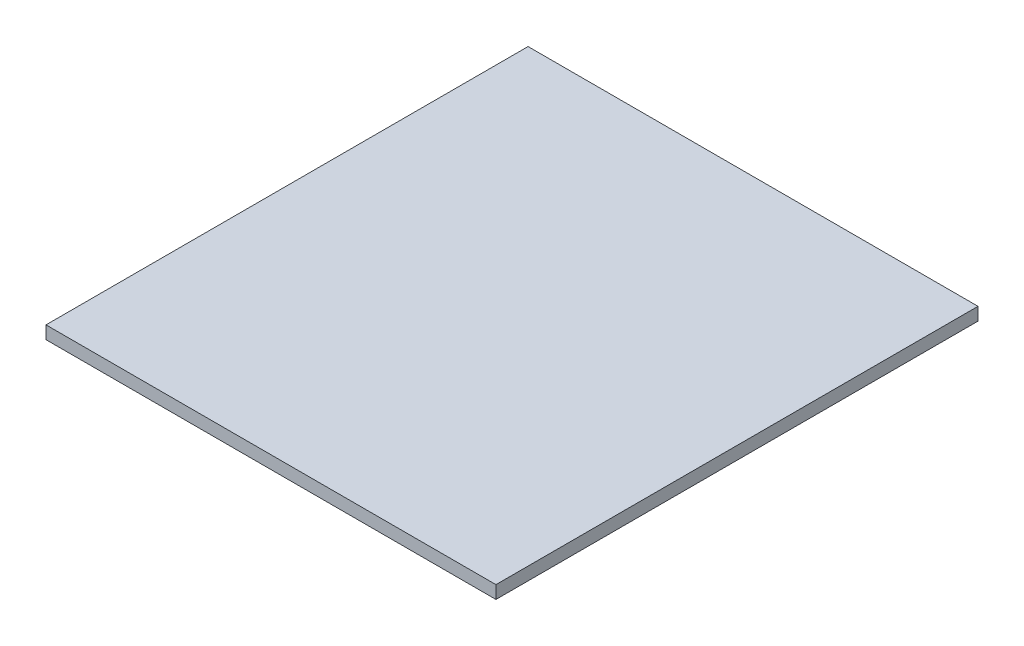
from build123d import *

# Parameters (mm, degrees)
SKETCH1_W  = 140
SKETCH1_H  = 150
BODY_DEPTH = 4


with BuildPart() as part:
    # Sketch1 → body (new body)
    with BuildSketch(Plane(origin=(0, 0, 0), x_dir=(1, 0, 0), z_dir=(0, 1, 0))):
        Rectangle(SKETCH1_W, SKETCH1_H)
    extrude(amount=BODY_DEPTH)


solid = part.part
